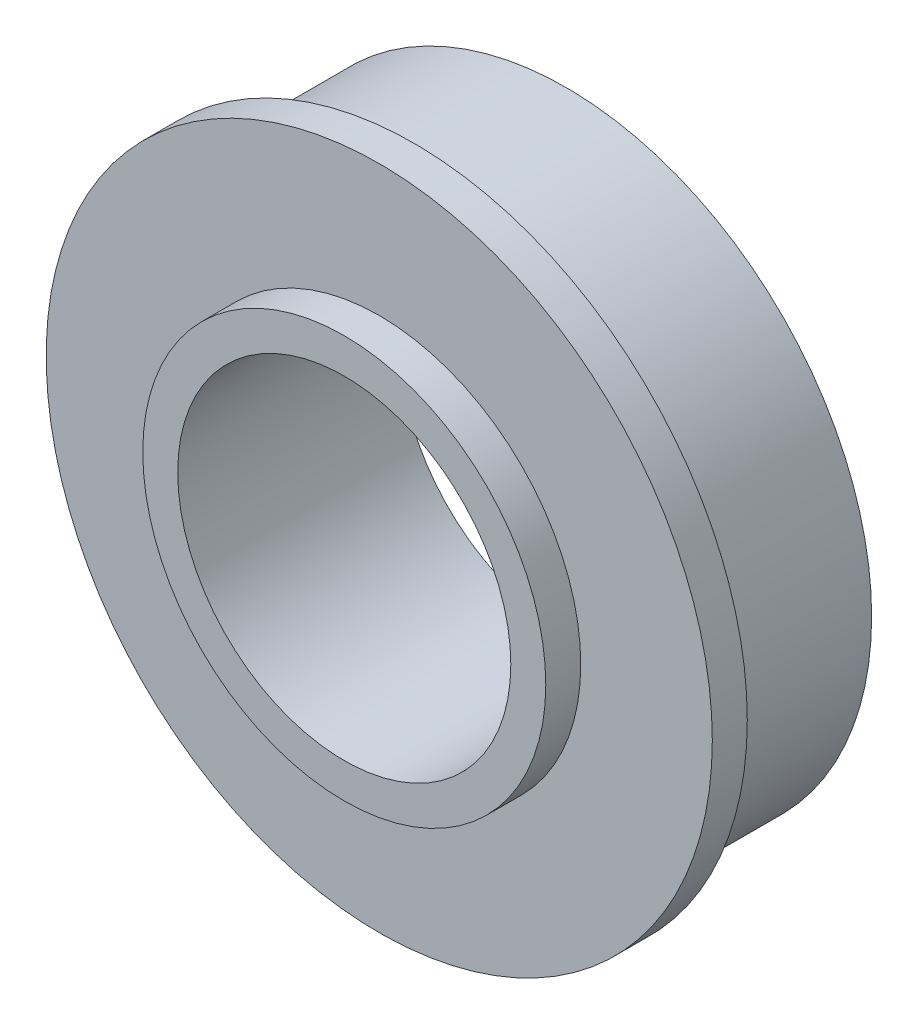
from build123d import *

# Parameters (mm, degrees)
SKETCH1_R           = 17.4625
SKETCH1_R_2         = 9.525
BOSS_EXTRUDE1_DEPTH = 8.7
SKETCH2_R           = 19.05
SKETCH2_R_2         = 9.525
BOSS_EXTRUDE2_DEPTH = 2
SKETCH3_R           = 11.525
SKETCH3_R_2         = 9.525
BOSS_EXTRUDE3_DEPTH = 2


with BuildPart() as part:
    # Sketch1 → Boss-Extrude1 (new body)
    with BuildSketch(Plane.XY):
        Circle(SKETCH1_R)
        Circle(SKETCH1_R_2, mode=Mode.SUBTRACT)
    extrude(amount=BOSS_EXTRUDE1_DEPTH)

    # Sketch2 → Boss-Extrude2 (add)
    with BuildSketch(Plane.XY.offset(8.7)):
        Circle(SKETCH2_R)
        Circle(SKETCH2_R_2, mode=Mode.SUBTRACT)
    extrude(amount=BOSS_EXTRUDE2_DEPTH)

    # Sketch3 → Boss-Extrude3 (add)
    with BuildSketch(Plane.XY.offset(10.7)):
        Circle(SKETCH3_R)
        Circle(SKETCH3_R_2, mode=Mode.SUBTRACT)
    extrude(amount=BOSS_EXTRUDE3_DEPTH)


solid = part.part
